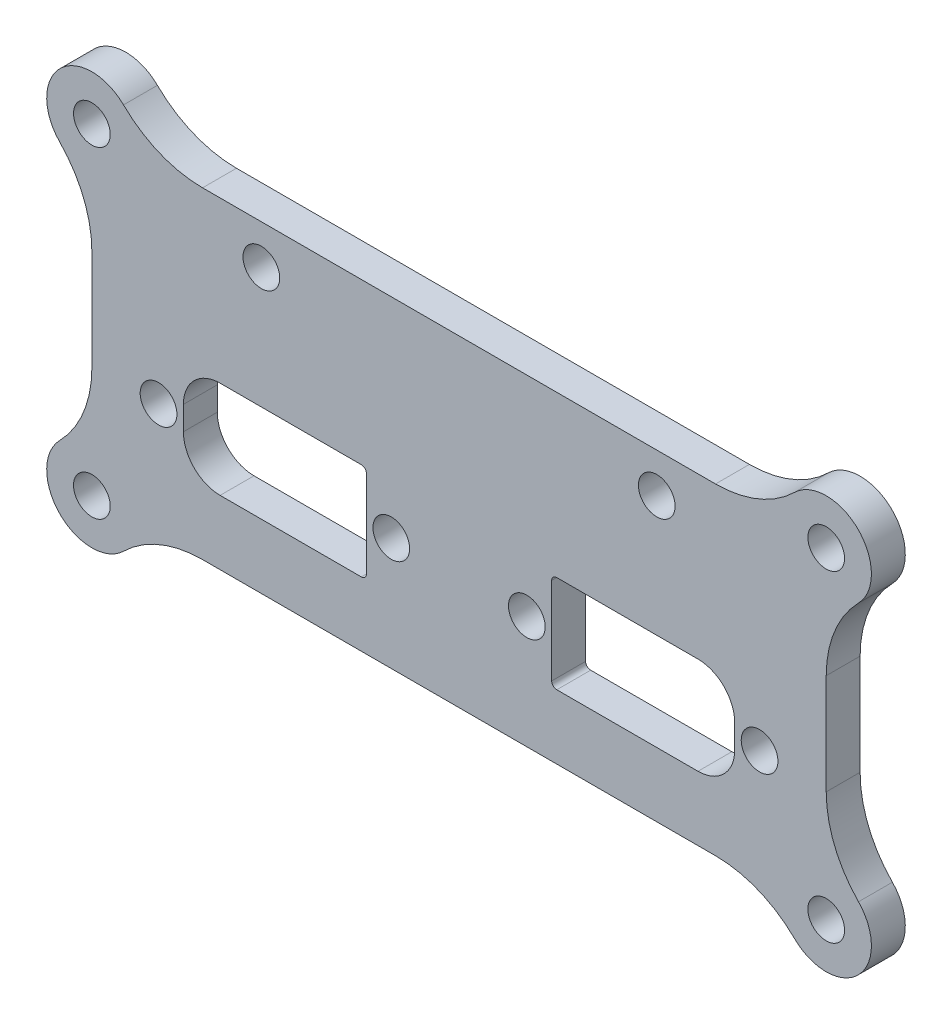
from build123d import *

# Parameters (mm, degrees)
SKETCH_1_R          = 1.625
EXTRUDE_1_DEPTH     = 3
FILLET_1_R          = 10
SKETCH_3_R          = 1.625
CUT_EXTRUDE_1_DEPTH = 10
SKETCH_4_R          = 1.625
CUT_EXTRUDE_2_DEPTH = 10
CUT_EXTRUDE_3_DEPTH = 10


with BuildPart() as part:
    # Эскиз1 → Бобышка-Вытянуть1 (new body)
    with BuildSketch(Plane.XY):
        with BuildLine():
            ThreePointArc((-32.5, 4), (-35.328427125, -2.828427125), (-28.5, 0))
            Line((-28.5, 0), (28.5, 0))
            ThreePointArc((28.5, 0), (35.328427125, -2.828427125), (32.5, 4))
            Line((32.5, 4), (32.5, 24.5))
            ThreePointArc((32.5, 24.5), (35.328427125, 31.328427125), (28.5, 28.5))
            Line((28.5, 28.5), (-28.5, 28.5))
            ThreePointArc((-28.5, 28.5), (-35.328427125, 31.328427125), (-32.5, 24.5))
            Line((-32.5, 24.5), (-32.5, 4))
        make_face()
        with Locations((-32.5, 0)):
            Circle(SKETCH_1_R, mode=Mode.SUBTRACT)
        with Locations((32.5, 28.5)):
            Circle(SKETCH_1_R, mode=Mode.SUBTRACT)
        with Locations((-32.5, 28.5)):
            Circle(SKETCH_1_R, mode=Mode.SUBTRACT)
        with Locations((32.5, 0)):
            Circle(SKETCH_1_R, mode=Mode.SUBTRACT)
    extrude(amount=EXTRUDE_1_DEPTH)

    # Скругление1
    fillet_1_edges = [part.edges().sort_by_distance(p)[0] for p in [
        (28.5, 0, 1.5),
        (-28.5, 0, 1.5),
        (-32.5, 4, 1.5),
        (-32.5, 24.5, 1.5),
        (-28.5, 28.5, 1.5),
        (28.5, 28.5, 1.5),
        (32.5, 24.5, 1.5),
        (32.5, 4, 1.5),
    ]]
    fillet(fillet_1_edges, radius=FILLET_1_R)

    # Эскиз3 → Вырез-Вытянуть1 (cut)
    with BuildSketch(Plane(origin=(0, 0, 0), x_dir=(-1, 0, 0), z_dir=(0, 0, -1))):
        with Locations((-17.5, 25)):
            Circle(SKETCH_3_R)
        with Locations(Location((17.5, 25, 0), (0, 0, 180))):
            Circle(SKETCH_3_R)
    extrude(amount=-CUT_EXTRUDE_1_DEPTH, mode=Mode.SUBTRACT)

    # Эскиз4 → Вырез-Вытянуть2 (cut)
    with BuildSketch(Plane.XY.offset(3)):
        with Locations((-26.6, 10)):
            Circle(SKETCH_4_R)
        with Locations((-6, 10)):
            Circle(SKETCH_4_R)
        with Locations((6, 10)):
            Circle(SKETCH_4_R)
        with Locations((26.6, 10)):
            Circle(SKETCH_4_R)
    extrude(amount=-CUT_EXTRUDE_2_DEPTH, mode=Mode.SUBTRACT)

    # Эскиз6 → Вырез-Вытянуть3 (cut)
    with BuildSketch(Plane.XY.offset(3)):
        with BuildLine():
            Line((-21.15, 14.3), (-8.65, 14.3))
            ThreePointArc((-8.65, 14.3), (-8.331801948, 14.168198052), (-8.2, 13.85))
            Line((-8.2, 13.85), (-8.2, 6.15))
            ThreePointArc((-8.2, 6.15), (-8.331801948, 5.831801948), (-8.65, 5.7))
            Line((-8.65, 5.7), (-21.15, 5.7))
            ThreePointArc((-21.15, 5.7), (-23.448097039, 6.651902961), (-24.4, 8.95))
            Line((-24.4, 8.95), (-24.4, 11.05))
            ThreePointArc((-24.4, 11.05), (-23.448097039, 13.348097039), (-21.15, 14.3))
        make_face()
    cut_extrude_3 = extrude(amount=-CUT_EXTRUDE_3_DEPTH, mode=Mode.SUBTRACT)

    # Зеркальное отражение1: Вырез-Вытянуть3 across plane
    add(cut_extrude_3.mirror(Plane(origin=(0, 0, 0), x_dir=(0, 0, 1), z_dir=(1, 0, 0))), mode=Mode.SUBTRACT)


solid = part.part
